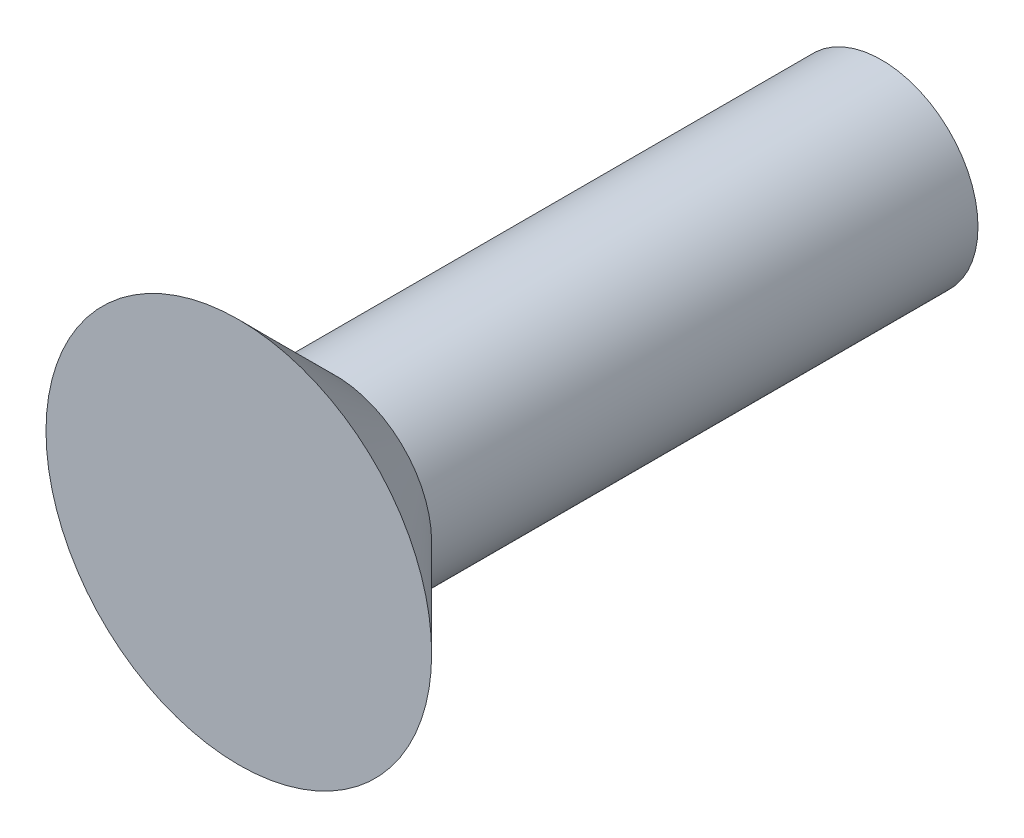
from build123d import *

# Parameters (mm, degrees)
NOMINAL_SHANK_START    = -10
SKETCH_NOMINAL_SHANK_R = 1.5
NOMINAL_SHANK_DEPTH    = 8.5
HEAD_START             = -1.5
SKETCH_HEAD_R          = 1.5
HEAD_DEPTH             = 1.5
HEAD_TAPER             = -45


with BuildPart() as part:
    # Sketch_Nominal_shank → Nominal_shank (new body)
    with BuildSketch(Plane.XY.offset(NOMINAL_SHANK_START)):
        Circle(SKETCH_NOMINAL_SHANK_R)
    extrude(amount=NOMINAL_SHANK_DEPTH)

    # Sketch_Head → Head (add)
    with BuildSketch(Plane.XY.offset(HEAD_START)):
        Circle(SKETCH_HEAD_R)
    extrude(amount=HEAD_DEPTH, taper=HEAD_TAPER)


solid = part.part
